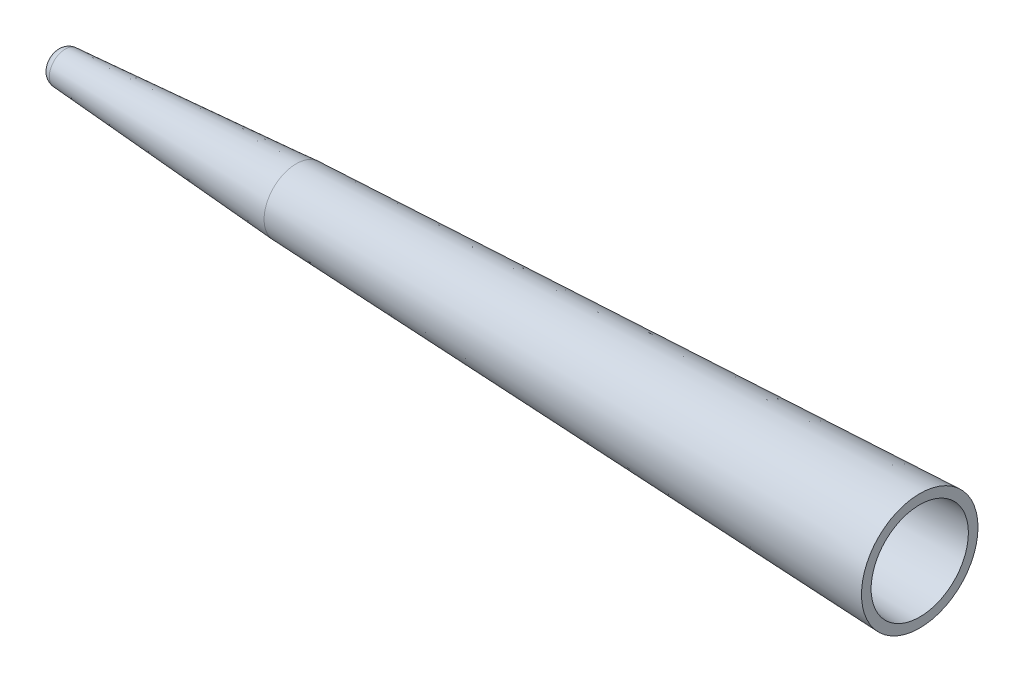
from build123d import *


with BuildPart() as part:
    # Sketch2 → Revolve2 (revolve)
    with BuildSketch(Plane.XY):
        with BuildLine():
            Line((0, 1.2), (50, 4.696340597))
            Line((50, 4.696340597), (50, 6.696340597))
            Line((50, 6.696340597), (1.851094968, 3.32944117))
            ThreePointArc((1.851094968, 3.32944117), (0.484525778, 2.648094905), (0, 1.2))
        make_face()
    revolve(axis=Axis((-19.275847123, 0, 0), (1, 0, 0)))


with BuildPart() as body_2:
    # Sketch3 → Revolve3 (revolve)
    with BuildSketch(Plane.XY):
        Polygon((50, 4.694584717), (180, 10.143199062), (180, 12.144954942), (50, 6.696340597), align=None)
    revolve(axis=Axis((50, 0, 0), (-1, 0, 0)))


solid = Compound([part.part, body_2.part])
